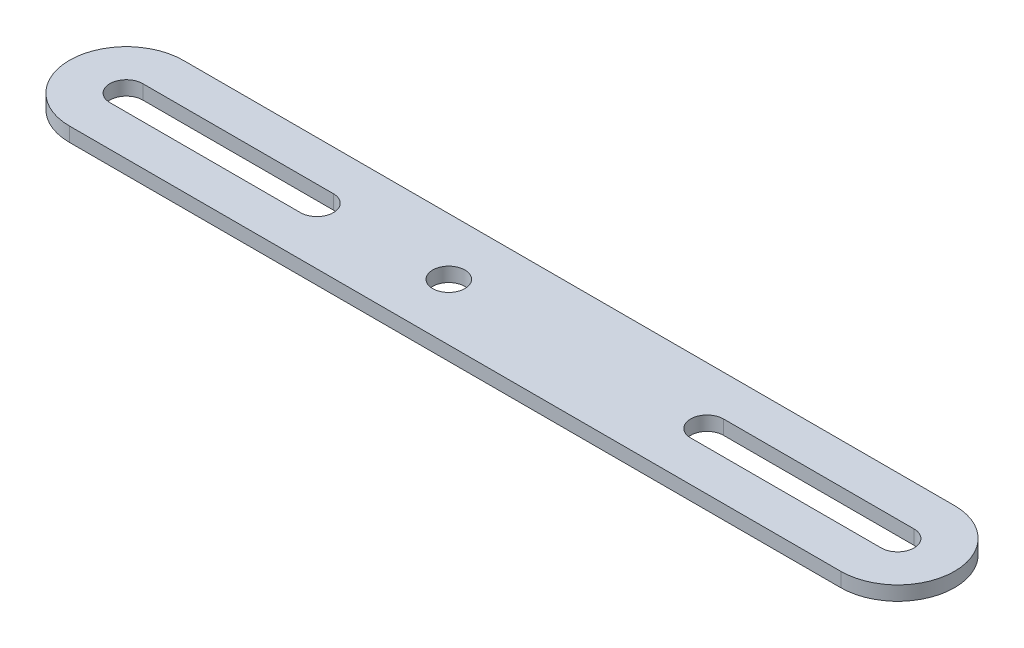
from build123d import *

# Parameters (mm, degrees)
SKETCH1_R           = 2.55
BOSS_EXTRUDE1_DEPTH = 2.25


with BuildPart() as part:
    # Sketch1 → Boss-Extrude1 (new body)
    with BuildSketch(Plane(origin=(0, 0, 0), x_dir=(1, 0, 0), z_dir=(0, 1, 0))):
        with BuildLine():
            Line((-61, 9), (61, 9))
            ThreePointArc((61, 9), (70, 0), (61, -9))
            Line((61, -9), (-61, -9))
            ThreePointArc((-61, -9), (-70, 0), (-61, 9))
        make_face()
        with Locations(Location((-10, 0, 0), (0, 0, 270))):
            Circle(SKETCH1_R, mode=Mode.SUBTRACT)
        with BuildLine():
            Line((-61, 2.6), (-30.85, 2.6))
            ThreePointArc((-30.85, 2.6), (-28.25, 0), (-30.85, -2.6))
            Line((-30.85, -2.6), (-61, -2.6))
            ThreePointArc((-61, -2.6), (-63.6, 0), (-61, 2.6))
        make_face(mode=Mode.SUBTRACT)
        with BuildLine():
            Line((61, -2.6), (30.85, -2.6))
            ThreePointArc((30.85, -2.6), (28.25, 0), (30.85, 2.6))
            Line((30.85, 2.6), (61, 2.6))
            ThreePointArc((61, 2.6), (63.6, 0), (61, -2.6))
        make_face(mode=Mode.SUBTRACT)
    extrude(amount=BOSS_EXTRUDE1_DEPTH)


solid = part.part
